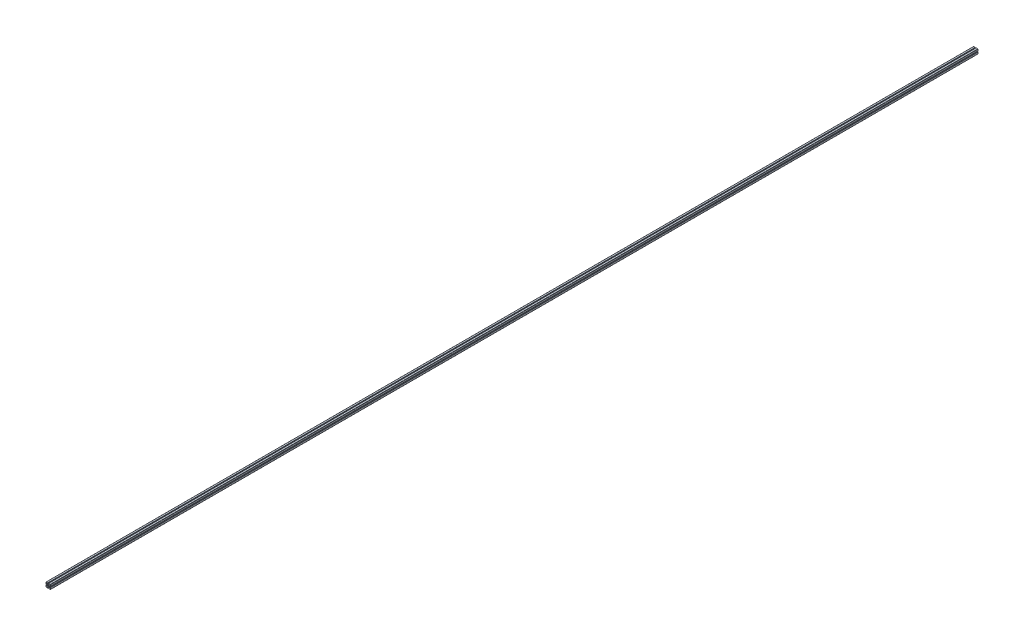
from build123d import *

# Parameters (mm, degrees)
EXTRUDE_1_DEPTH          = 1223
EXTRUDE_1_DEPTH_BACK     = 7111
SKETCH_1_W               = 40
SKETCH_1_H               = 40
SKETCH_2_R               = 4.05
CUT_EXTRUDE_1_DEPTH      = 10000
CUT_EXTRUDE_2_DEPTH      = 10000
FILLET_1_R               = 1
PATTERN_CIRCULAR_2_COUNT = 4
FILLET_2_R               = 1
FILLET_3_R               = 1
FILLET_4_R               = 1
FILLET_5_R               = 2


with BuildPart() as part:
    # 草图1 → 凸台-拉伸1 (new, two sides: drawn at the far end of the back side and taken through both)
    with BuildSketch(Plane.XY.offset(-EXTRUDE_1_DEPTH_BACK)):
        Rectangle(SKETCH_1_W, SKETCH_1_H)
    extrude(amount=EXTRUDE_1_DEPTH + EXTRUDE_1_DEPTH_BACK)

    # 草图2 → 切除-拉伸1 (cut)
    with BuildSketch(Plane.XY.offset(1223)):
        Circle(SKETCH_2_R)
    extrude(amount=-CUT_EXTRUDE_1_DEPTH, mode=Mode.SUBTRACT)

    # 草图4 → 切除-拉伸2 (cut)
    with BuildSketch(Plane.XY.offset(1223)):
        Polygon((20, 0), (20, 4), (16, 4), (16, 10.5), (7.876860985, 2.6), (7.876860985, -2.6), (16, -10.5), (16, -2.65197969), (20, -2.65197969), align=None)
    cut_extrude_2 = extrude(amount=-CUT_EXTRUDE_2_DEPTH, mode=Mode.SUBTRACT)

    # 圆角1
    fillet_1_edges = [part.edges().sort_by_distance(p)[0] for p in [
        (20, -2.65197969, -2944),
        (16, -2.65197969, -2944),
        (16, -10.5, -2944),
        (7.876860985, -2.6, -2944),
        (7.876860985, 2.6, -2944),
        (16, 10.5, -2944),
        (16, 4, -2944),
        (20, 4, -2944),
    ]]
    fillet(fillet_1_edges, radius=FILLET_1_R)

    # 阵列(圆周)2: 切除-拉伸2 ×4 about axis
    pattern_circular_2_axis = Axis((0, 0, 0), (0, 0, 1))
    for i in range(1, PATTERN_CIRCULAR_2_COUNT):
        add(cut_extrude_2.rotate(pattern_circular_2_axis, i * 360 / PATTERN_CIRCULAR_2_COUNT), mode=Mode.SUBTRACT)

    # 圆角2
    fillet_2_edges = [part.edges().sort_by_distance(p)[0] for p in [
        (2.65197969, 20, -2944),
        (2.65197969, 16, -2944),
        (10.5, 16, -2944),
        (2.6, 7.876860985, -2944),
        (-2.6, 7.876860985, -2944),
        (-10.5, 16, -2944),
        (-4, 16, -2944),
        (-4, 20, -2944),
    ]]
    fillet(fillet_2_edges, radius=FILLET_2_R)

    # 圆角3
    fillet_3_edges = [part.edges().sort_by_distance(p)[0] for p in [
        (-20, 2.65197969, -2944),
        (-16, 2.65197969, -2944),
        (-16, 10.5, -2944),
        (-7.876860985, 2.6, -2944),
        (-7.876860985, -2.6, -2944),
        (-16, -10.5, -2944),
        (-16, -4, -2944),
        (-20, -4, -2944),
    ]]
    fillet(fillet_3_edges, radius=FILLET_3_R)

    # 圆角4
    fillet_4_edges = [part.edges().sort_by_distance(p)[0] for p in [
        (-2.65197969, -20, -2944),
        (-2.65197969, -16, -2944),
        (-10.5, -16, -2944),
        (-2.6, -7.876860985, -2944),
        (2.6, -7.876860985, -2944),
        (10.5, -16, -2944),
        (4, -16, -2944),
        (4, -20, -2944),
    ]]
    fillet(fillet_4_edges, radius=FILLET_4_R)

    # 圆角5
    fillet_5_edges = [part.edges().sort_by_distance(p)[0] for p in [
        (20, -20, -2944),
        (-20, -20, -2944),
        (-20, 20, -2944),
        (20, 20, -2944),
    ]]
    fillet(fillet_5_edges, radius=FILLET_5_R)


solid = part.part
